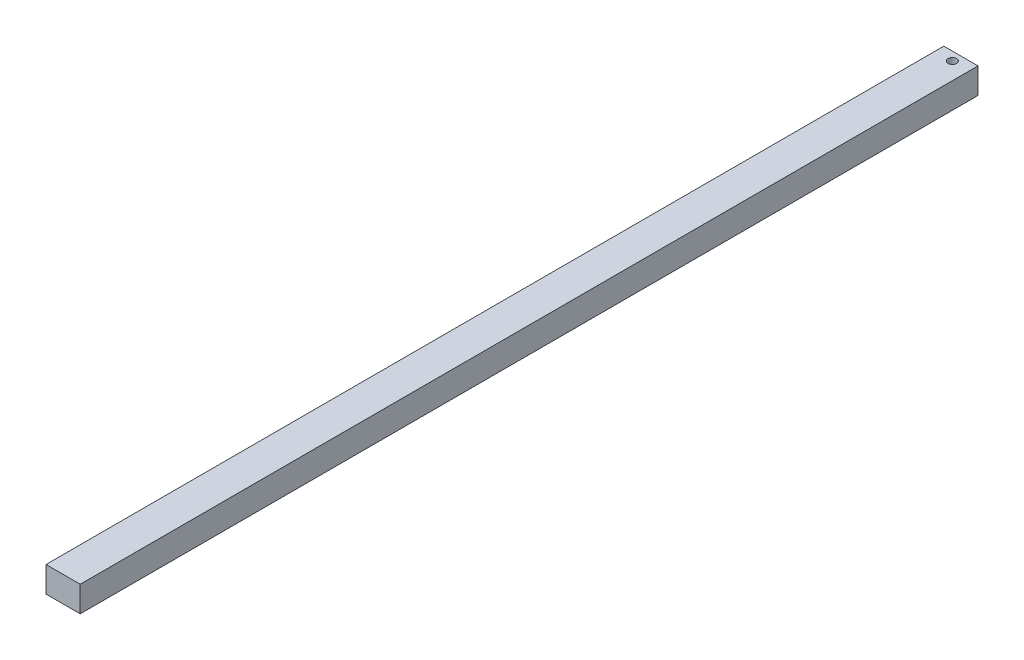
from build123d import *

# Parameters (mm, degrees)
SKETCH_1_W          = 40
SKETCH_1_H          = 1050
SKETCH_1_R          = 5
EXTRUDE_1_DEPTH     = 30
SKETCH_4_W          = 20
SKETCH_4_H          = 20
CUT_EXTRUDE_1_DEPTH = 15
SKETCH_6_R          = 3
CUT_EXTRUDE_2_DEPTH = 20


with BuildPart() as part:
    # 草图1 → 凸台-拉伸1 (new body)
    with BuildSketch(Plane(origin=(0, 0, 0), x_dir=(1, 0, 0), z_dir=(0, 1, 0))):
        Rectangle(SKETCH_1_W, SKETCH_1_H)
        with Locations(Location((0, 515, 0), (0, 0, 270))):
            Circle(SKETCH_1_R, mode=Mode.SUBTRACT)
    extrude(amount=EXTRUDE_1_DEPTH)

    # 草图4 → 切除-拉伸1 (cut)
    with BuildSketch(Plane.XZ):
        Rectangle(SKETCH_4_W, SKETCH_4_H)
    extrude(amount=-CUT_EXTRUDE_1_DEPTH, mode=Mode.SUBTRACT)

    # 草图6 → 切除-拉伸2 (cut)
    with BuildSketch(Plane(origin=(0, 0, 10), x_dir=(-1, 0, 0), z_dir=(0, 0, -1))):
        with Locations((-5, 5.5)):
            Circle(SKETCH_6_R)
    extrude(amount=-CUT_EXTRUDE_2_DEPTH, mode=Mode.SUBTRACT)


solid = part.part
